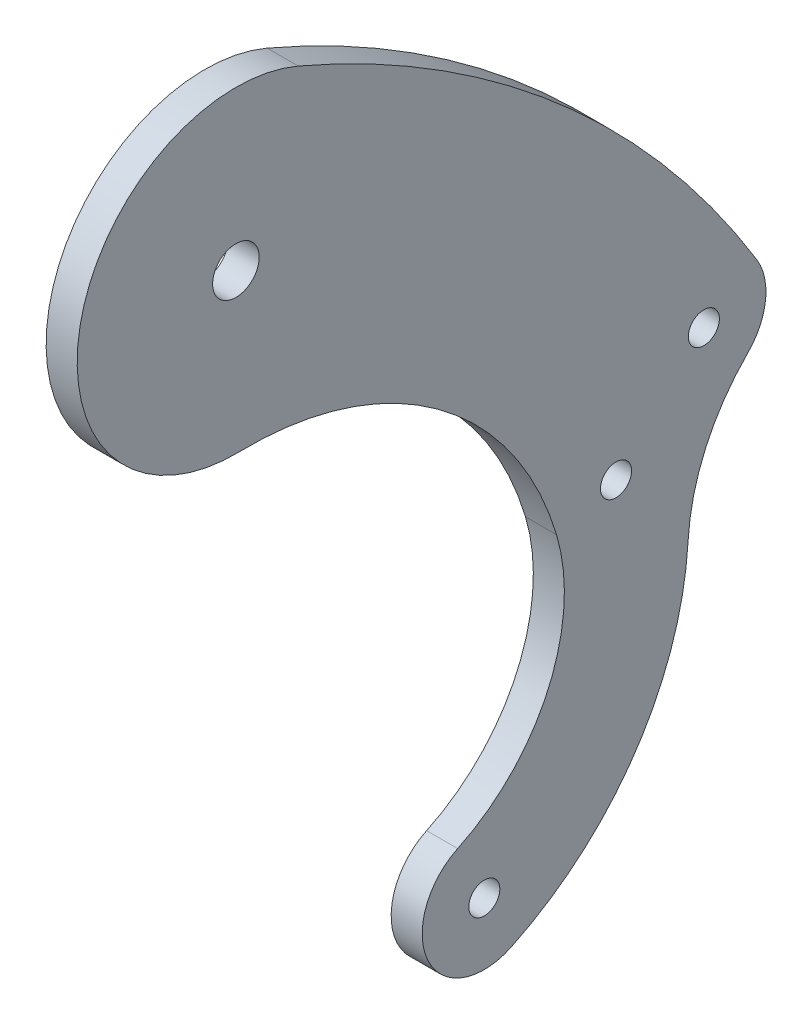
from build123d import *

# Parameters (mm, degrees)
SKETCH1_R           = 3.175
BOSS_EXTRUDE1_DEPTH = 6.35
BOSS_EXTRUDE2_START = -6.35
SKETCH2_R           = 4.7625
BOSS_EXTRUDE2_DEPTH = 6.35


with BuildPart() as part:
    # Sketch1 → Boss-Extrude1 (new body)
    with BuildSketch(Plane(origin=(0, 0, 0), x_dir=(0, 0, -1), z_dir=(1, 0, 0))):
        with BuildLine():
            Line((-8.980256121, 8.980256121), (8.980256121, 26.940768363))
            ThreePointArc((8.980256121, 26.940768363), (26.940768363, 26.940768363), (26.940768363, 8.980256121))
            ThreePointArc((26.940768363, 8.980256121), (18.331397871, -3.512535502), (14.733533544, -18.2518189))
            ThreePointArc((14.733533544, -18.2518189), (3.99537448, -50.125222998), (-21.49411099, -72.068515352))
            ThreePointArc((-21.49411099, -72.068515352), (-38.413515352, -66.042425736), (-32.387425736, -49.123021375))
            ThreePointArc((-32.387425736, -49.123021375), (-13.857306444, -30.125859248), (-12.166610815, -3.641919999))
            ThreePointArc((-12.166610815, -3.641919999), (-12.313704877, 3.108483907), (-8.980256121, 8.980256121))
        make_face()
        Circle(SKETCH1_R, mode=Mode.SUBTRACT)
        with Locations((17.960512242, 17.960512242)):
            Circle(SKETCH1_R, mode=Mode.SUBTRACT)
        with Locations((-26.940768363, -60.595768363)):
            Circle(SKETCH1_R, mode=Mode.SUBTRACT)
    extrude(amount=BOSS_EXTRUDE1_DEPTH)

    # Sketch2 → Boss-Extrude2 (add)
    with BuildSketch(Plane(origin=(6.35, 0, 0), x_dir=(0, 0, -1), z_dir=(1, 0, 0)).offset(BOSS_EXTRUDE2_START)):
        with BuildLine():
            Line((-8.980256121, 8.980256121), (8.980256121, 26.940768363))
            ThreePointArc((8.980256121, 26.940768363), (19.47129419, 30.570331349), (28.80800074, 24.565207034))
            ThreePointArc((28.80800074, 24.565207034), (-11.744974479, 72.511118598), (-65.000542096, 105.785714805))
            ThreePointArc((-65.000542096, 105.785714805), (-109.616580791, 82.065642196), (-76.995649237, 43.476685512))
            ThreePointArc((-76.995649237, 43.476685512), (-36.623825936, 30.865592429), (-12.166610815, -3.641919999))
            ThreePointArc((-12.166610815, -3.641919999), (-12.313704877, 3.108483907), (-8.980256121, 8.980256121))
        make_face()
        with Locations((-77.740768363, 75.929231637)):
            Circle(SKETCH2_R, mode=Mode.SUBTRACT)
    extrude(amount=BOSS_EXTRUDE2_DEPTH)


solid = part.part
